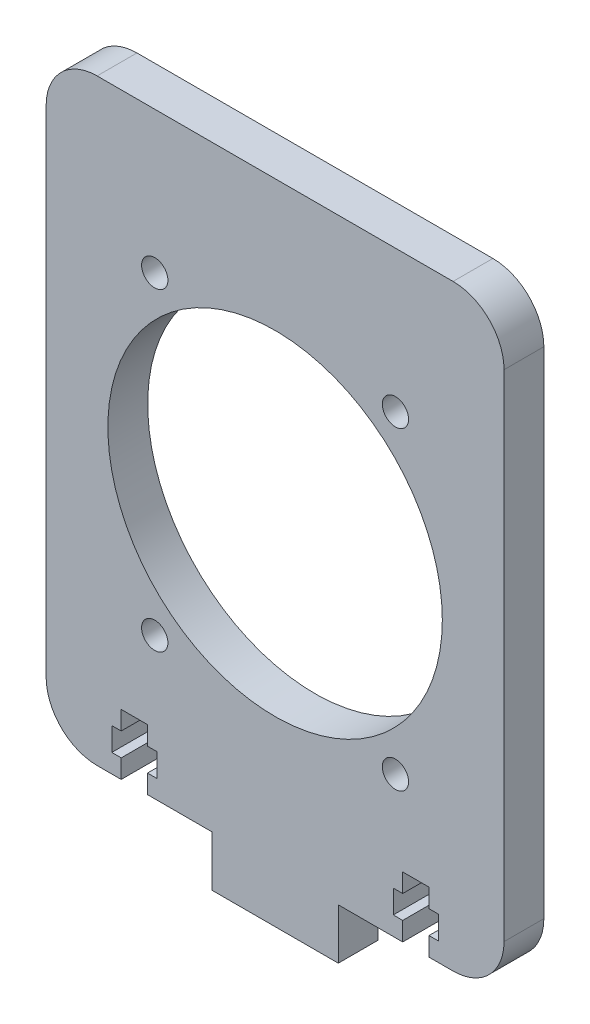
from build123d import *

# Parameters (mm, degrees)
SKETCH1_W           = 115
SKETCH1_H           = 150
SKETCH1_R           = 42
SKETCH1_R_2         = 3.3
BOSS_EXTRUDE1_DEPTH = 10
CUT_EXTRUDE1_DEPTH  = 96.032889044
BOSS_EXTRUDE2_DEPTH = 12.7
FILLET1_R           = 12.8


with BuildPart() as part:
    # Sketch1 → Boss-Extrude1 (new body)
    with BuildSketch(Plane.XY):
        Rectangle(SKETCH1_W, SKETCH1_H)
        Circle(SKETCH1_R, mode=Mode.SUBTRACT)
        with Locations((-30.226879089, 39.426364029)):
            Circle(SKETCH1_R_2, mode=Mode.SUBTRACT)
        with Locations((30.226879089, 39.426364029)):
            Circle(SKETCH1_R_2, mode=Mode.SUBTRACT)
        with Locations((30.226879089, -39.426364029)):
            Circle(SKETCH1_R_2, mode=Mode.SUBTRACT)
        with Locations((-30.226879089, -39.426364029)):
            Circle(SKETCH1_R_2, mode=Mode.SUBTRACT)
    extrude(amount=BOSS_EXTRUDE1_DEPTH)

    # Sketch2 → Cut-Extrude1 (cut, through all)
    with BuildSketch(Plane(origin=(0, 0, 0), x_dir=(-1, 0, 0), z_dir=(0, 0, -1))):
        Polygon((-38.65, -75), (-32.05, -75), (-32.05, -70.3), (-29.686, -70.3), (-29.686, -64.46), (-32.05, -64.46), (-32.05, -59.76), (-38.65, -59.76), (-38.65, -64.46), (-41.014, -64.46), (-41.014, -70.3), (-38.65, -70.3), align=None)
        Polygon((32.05, -75), (32.05, -70.3), (29.686, -70.3), (29.686, -64.46), (32.05, -64.46), (32.05, -59.76), (38.65, -59.76), (38.65, -64.46), (41.014, -64.46), (41.014, -70.3), (38.65, -70.3), (38.65, -75), align=None)
    extrude(amount=-CUT_EXTRUDE1_DEPTH, mode=Mode.SUBTRACT)

    # Sketch4 → Boss-Extrude2 (add)
    with BuildSketch(Plane.XZ.offset(75)):
        Polygon((0, 0), (15.875, 0), (15.875, 10), (-15.875, 10), (-15.875, 0), align=None)
    extrude(amount=BOSS_EXTRUDE2_DEPTH)

    # Fillet1
    fillet1_edges = [part.edges().sort_by_distance(p)[0] for p in [
        (57.5, -75, 5),
        (-57.5, -75, 5),
        (-57.5, 75, 5),
        (57.5, 75, 5),
    ]]
    fillet(fillet1_edges, radius=FILLET1_R)


solid = part.part
